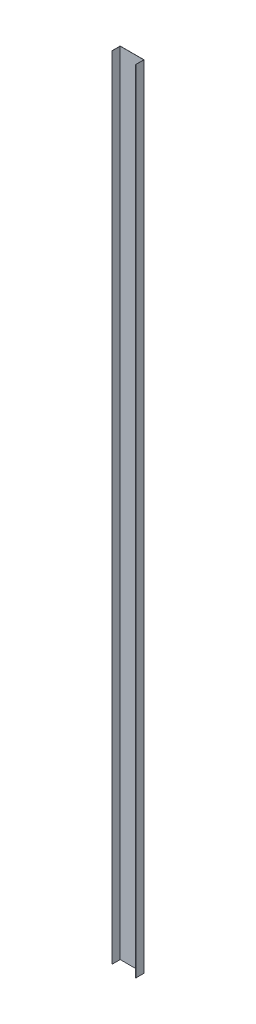
from build123d import *

# Parameters (mm, degrees)
BOSS_EXTRUDE1_DEPTH = 3048


with BuildPart() as part:
    # Sketch1 → Boss-Extrude1 (new body)
    with BuildSketch(Plane(origin=(0, 0, 0), x_dir=(1, 0, 0), z_dir=(0, 1, 0))):
        Polygon((0, 0), (0, 31.219), (91.013, 31.219), (91.013, 0), (91.544, 0), (91.544, 31.75), (-0.531, 31.75), (-0.531, 0), align=None)
    extrude(amount=BOSS_EXTRUDE1_DEPTH)


solid = part.part
